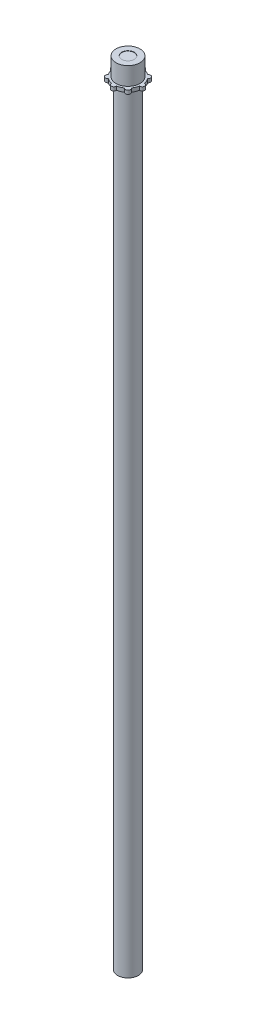
from build123d import *

# Parameters (mm, degrees)
SKETCH2_R           = 7.874
BOSS_EXTRUDE1_DEPTH = 586.74
BOSS_EXTRUDE3_DEPTH = 2.794
SKETCH4_R           = 9.144
BOSS_EXTRUDE4_DEPTH = 13.716
SKETCH6_R           = 4.7625
CUT_EXTRUDE1_DEPTH  = 0.254


with BuildPart() as part:
    # Sketch2 → Boss-Extrude1 (new body)
    with BuildSketch(Plane(origin=(0, 0, 0), x_dir=(1, 0, 0), z_dir=(0, 1, 0))):
        with Locations(Location((0, 0, 0), (0, 0, 270))):
            Circle(SKETCH2_R)
    extrude(amount=BOSS_EXTRUDE1_DEPTH)

    # Sketch3 → Boss-Extrude3 (add)
    with BuildSketch(Plane(origin=(0, 586.74, 0), x_dir=(1, 0, 0), z_dir=(0, 1, 0))):
        with BuildLine():
            ThreePointArc((-8.856145882, 6.172576861), (-9.973279553, 4.131067652), (-10.626911765, 1.897569853))
            ThreePointArc((-10.626911765, 1.897569853), (-12.7, 0), (-10.626911765, -1.897569853))
            ThreePointArc((-10.626911765, -1.897569853), (-9.973279553, -4.131067652), (-8.856145882, -6.172576861))
            ThreePointArc((-8.856145882, -6.172576861), (-8.980256121, -8.980256121), (-6.172576861, -8.856145882))
            ThreePointArc((-6.172576861, -8.856145882), (-4.131067652, -9.973279553), (-1.897569853, -10.626911765))
            ThreePointArc((-1.897569853, -10.626911765), (0, -12.7), (1.897569853, -10.626911765))
            ThreePointArc((1.897569853, -10.626911765), (4.131067652, -9.973279553), (6.172576861, -8.856145882))
            ThreePointArc((6.172576861, -8.856145882), (8.980256121, -8.980256121), (8.856145882, -6.172576861))
            ThreePointArc((8.856145882, -6.172576861), (9.973279553, -4.131067652), (10.626911765, -1.897569853))
            ThreePointArc((10.626911765, -1.897569853), (12.7, 0), (10.626911765, 1.897569853))
            ThreePointArc((10.626911765, 1.897569853), (9.973279553, 4.131067652), (8.856145882, 6.172576861))
            ThreePointArc((8.856145882, 6.172576861), (8.980256121, 8.980256121), (6.172576861, 8.856145882))
            ThreePointArc((6.172576861, 8.856145882), (4.131067652, 9.973279553), (1.897569853, 10.626911765))
            ThreePointArc((1.897569853, 10.626911765), (0, 12.7), (-1.897569853, 10.626911765))
            ThreePointArc((-1.897569853, 10.626911765), (-4.131067652, 9.973279553), (-6.172576861, 8.856145882))
            ThreePointArc((-6.172576861, 8.856145882), (-8.980256121, 8.980256121), (-8.856145882, 6.172576861))
        make_face()
    extrude(amount=BOSS_EXTRUDE3_DEPTH)

    # Sketch4 → Boss-Extrude4 (add)
    with BuildSketch(Plane(origin=(0, 589.534, 0), x_dir=(1, 0, 0), z_dir=(0, 1, 0))):
        with Locations(Location((0, 0, 0), (0, 0, 270))):
            Circle(SKETCH4_R)
    extrude(amount=BOSS_EXTRUDE4_DEPTH)

    # Sketch6 → Cut-Extrude1 (cut)
    with BuildSketch(Plane(origin=(0, 603.25, 0), x_dir=(1, 0, 0), z_dir=(0, 1, 0))):
        with Locations(Location((0, 0, 0), (0, 0, 270))):
            Circle(SKETCH6_R)
    extrude(amount=-CUT_EXTRUDE1_DEPTH, mode=Mode.SUBTRACT)


solid = part.part
